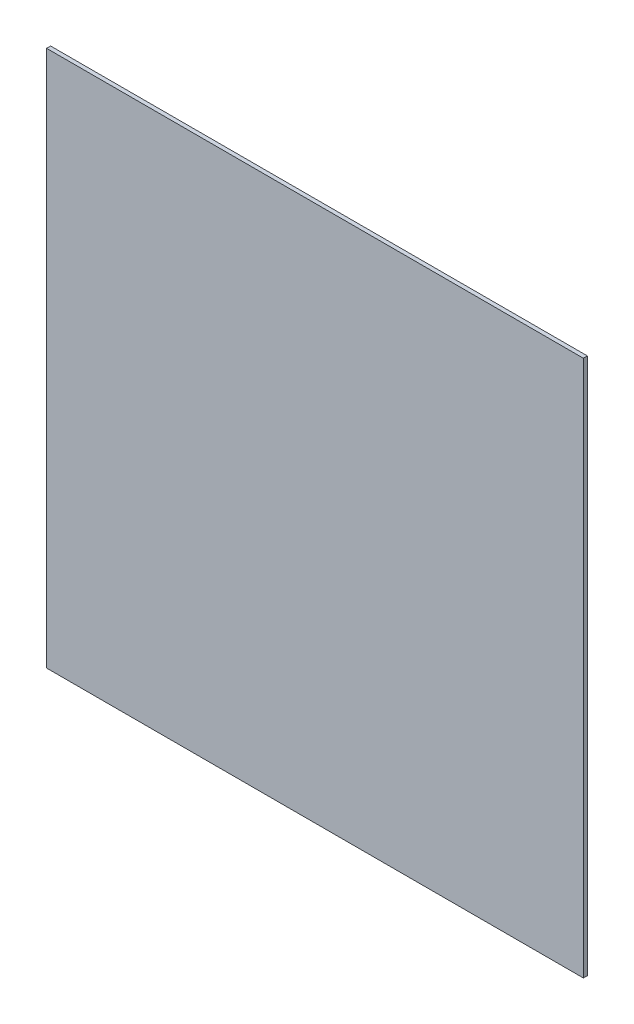
from build123d import *

# Parameters (mm, degrees)
SKETCH1_W      = 40
SKETCH1_H      = 40
EXTRUDE1_DEPTH = 0.3


with BuildPart() as part:
    # Sketch1 → Extrude1 (new body)
    with BuildSketch(Plane.XY):
        with Locations((20, 20)):
            Rectangle(SKETCH1_W, SKETCH1_H)
    extrude(amount=-EXTRUDE1_DEPTH)


solid = part.part
